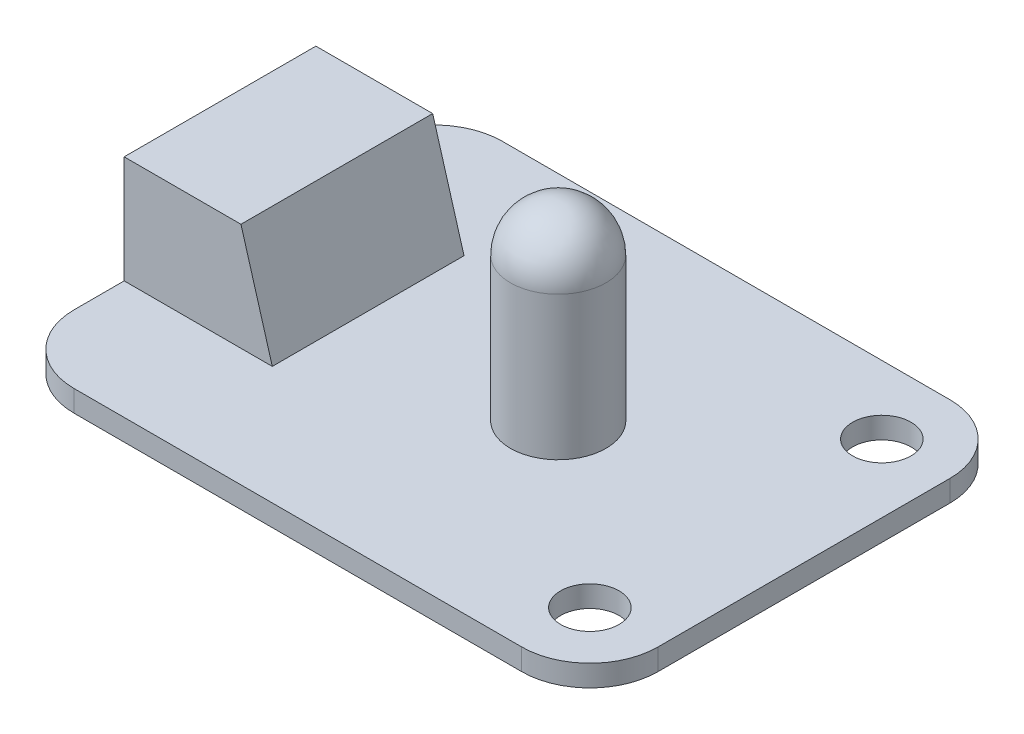
from build123d import *

# Parameters (mm, degrees)
SKETCH1_R           = 1.5
BOSS_EXTRUDE1_DEPTH = 1.1
SKETCH2_R           = 2.455
BOSS_EXTRUDE2_DEPTH = 7.365
DOME1_FACE_RADIUS   = 2.455
DOME1_HEIGHT        = 2.455
SKETCH9_W           = 6
SKETCH9_H           = 9.85
BOSS_EXTRUDE3_DEPTH = 5.52
BOSS_EXTRUDE4_DEPTH = 9.85


with BuildPart() as part:
    # Sketch1 → Boss-Extrude1 (new body)
    with BuildSketch(Plane(origin=(0, 0, 0), x_dir=(1, 0, 0), z_dir=(0, 1, 0))):
        with BuildLine():
            Line((3.5, 0), (26.5, 0))
            ThreePointArc((26.5, 0), (28.974873734, 1.025126266), (30, 3.5))
            Line((30, 3.5), (30, 18.5))
            ThreePointArc((30, 18.5), (28.974873734, 20.974873734), (26.5, 22))
            Line((26.5, 22), (3.5, 22))
            ThreePointArc((3.5, 22), (1.025126266, 20.974873734), (0, 18.5))
            Line((0, 18.5), (0, 3.5))
            ThreePointArc((0, 3.5), (1.025126266, 1.025126266), (3.5, 0))
        make_face()
        with Locations(Location((26.5, 18.5, 0), (0, 0, 270))):
            Circle(SKETCH1_R, mode=Mode.SUBTRACT)
        with Locations(Location((26.5, 3.5, 0), (0, 0, 270))):
            Circle(SKETCH1_R, mode=Mode.SUBTRACT)
    extrude(amount=BOSS_EXTRUDE1_DEPTH)

    # Sketch2 → Boss-Extrude2 (add)
    with BuildSketch(Plane(origin=(0, 1.1, 0), x_dir=(1, 0, 0), z_dir=(0, 1, 0))):
        with Locations(Location((17.375, 11, 0), (0, 0, 270))):
            Circle(SKETCH2_R)
    extrude(amount=BOSS_EXTRUDE2_DEPTH)

    # Dome1: a dome of height H over a round flat face of radius A is a cap of a sphere of radius (A * A + H * H) / (2 * H)
    dome1_r = (DOME1_FACE_RADIUS * DOME1_FACE_RADIUS + DOME1_HEIGHT * DOME1_HEIGHT) / (2 * DOME1_HEIGHT)
    dome1_base = Plane((17.375, 8.465, -11), z_dir=(0, 1, 0))
    with Locations(dome1_base.offset(DOME1_HEIGHT - dome1_r)):
        dome1_ball = Sphere(dome1_r, mode=Mode.PRIVATE)
    add(split(dome1_ball, bisect_by=dome1_base, keep=Keep.TOP, mode=Mode.PRIVATE))

    # Sketch9 → Boss-Extrude3 (add)
    with BuildSketch(Plane(origin=(0, 1.1, 0), x_dir=(1, 0, 0), z_dir=(0, 1, 0))):
        with Locations((3, 11)):
            Rectangle(SKETCH9_W, SKETCH9_H)
    extrude(amount=BOSS_EXTRUDE3_DEPTH)

    # Sketch11 → Boss-Extrude4 (add)
    with BuildSketch(Plane(origin=(0, 0, -15.925), x_dir=(-1, 0, 0), z_dir=(0, 0, -1))):
        Polygon((0, 1.1), (-7.61, 1.1), (-6, 6.62), (0, 6.62), align=None)
    extrude(amount=-BOSS_EXTRUDE4_DEPTH)


solid = part.part
